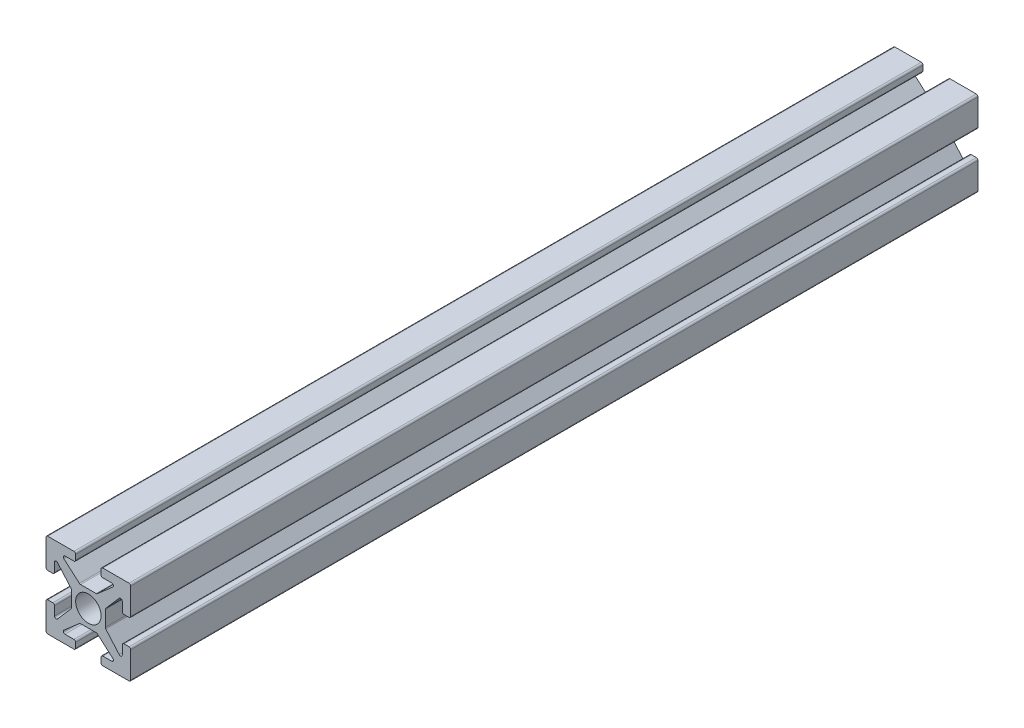
from build123d import *

# Parameters (mm, degrees)
MODEL_R             = 1.5
BOSS_EXTRUDE1_DEPTH = 100


with BuildPart() as part:
    # Model → Boss-Extrude1 (new body)
    with BuildSketch(Plane.XY):
        with BuildLine():
            Line((1314.74049485, 1308.470665301), (1314.74049485, 1305.370671501))
            ThreePointArc((1314.74049485, 1305.370671501), (1314.681916323, 1305.229250427), (1314.54049525, 1305.170671901))
            Line((1314.54049525, 1305.170671901), (1311.44050145, 1305.170671901))
            ThreePointArc((1311.44050145, 1305.170671901), (1311.299080376, 1305.229250427), (1311.24050185, 1305.370671501))
            Line((1311.24050185, 1305.370671501), (1311.24050185, 1305.970670301))
            ThreePointArc((1311.24050185, 1305.970670301), (1311.299080376, 1306.112091374), (1311.44050145, 1306.170669901))
            Line((1311.44050145, 1306.170669901), (1312.499844139, 1306.170669901))
            ThreePointArc((1312.499844139, 1306.170669901), (1312.687118906, 1306.300469773), (1312.631310779, 1306.521388984))
            Line((1312.631310779, 1306.521388984), (1310.796999872, 1308.121385784))
            ThreePointArc((1310.796999872, 1308.121385784), (1310.735732961, 1308.157941067), (1310.665533233, 1308.170665901))
            Line((1310.665533233, 1308.170665901), (1308.815476467, 1308.170665901))
            ThreePointArc((1308.815476467, 1308.170665901), (1308.745276739, 1308.157941067), (1308.684009827, 1308.121385784))
            Line((1308.684009827, 1308.121385784), (1306.849698921, 1306.521388984))
            ThreePointArc((1306.849698921, 1306.521388984), (1306.793890794, 1306.300469773), (1306.98116556, 1306.170669901))
            Line((1306.98116556, 1306.170669901), (1308.04050825, 1306.170669901))
            ThreePointArc((1308.04050825, 1306.170669901), (1308.181929323, 1306.112091374), (1308.24050785, 1305.970670301))
            Line((1308.24050785, 1305.970670301), (1308.24050785, 1305.370671501))
            ThreePointArc((1308.24050785, 1305.370671501), (1308.181929323, 1305.229250427), (1308.04050825, 1305.170671901))
            Line((1308.04050825, 1305.170671901), (1304.94051445, 1305.170671901))
            ThreePointArc((1304.94051445, 1305.170671901), (1304.799093376, 1305.229250427), (1304.74051485, 1305.370671501))
            Line((1304.74051485, 1305.370671501), (1304.74051485, 1308.470665301))
            ThreePointArc((1304.74051485, 1308.470665301), (1304.799093376, 1308.612086374), (1304.94051445, 1308.670664901))
            Line((1304.94051445, 1308.670664901), (1305.54051325, 1308.670664901))
            ThreePointArc((1305.54051325, 1308.670664901), (1305.681934323, 1308.612086374), (1305.74051285, 1308.470665301))
            Line((1305.74051285, 1308.470665301), (1305.74051285, 1307.411322611))
            ThreePointArc((1305.74051285, 1307.411322611), (1305.870312722, 1307.224047845), (1306.091231933, 1307.279855972))
            Line((1306.091231933, 1307.279855972), (1307.691228733, 1309.114166878))
            ThreePointArc((1307.691228733, 1309.114166878), (1307.727784016, 1309.17543379), (1307.74050885, 1309.245633518))
            Line((1307.74050885, 1309.245633518), (1307.74050885, 1311.095690284))
            ThreePointArc((1307.74050885, 1311.095690284), (1307.727784016, 1311.165890012), (1307.691228733, 1311.227156923))
            Line((1307.691228733, 1311.227156923), (1306.091231933, 1313.06146783))
            ThreePointArc((1306.091231933, 1313.06146783), (1305.870312722, 1313.117275957), (1305.74051285, 1312.93000119))
            Line((1305.74051285, 1312.93000119), (1305.74051285, 1311.870658501))
            ThreePointArc((1305.74051285, 1311.870658501), (1305.681934323, 1311.729237427), (1305.54051325, 1311.670658901))
            Line((1305.54051325, 1311.670658901), (1304.94051445, 1311.670658901))
            ThreePointArc((1304.94051445, 1311.670658901), (1304.799093376, 1311.729237427), (1304.74051485, 1311.870658501))
            Line((1304.74051485, 1311.870658501), (1304.74051485, 1314.970652301))
            ThreePointArc((1304.74051485, 1314.970652301), (1304.799093376, 1315.112073374), (1304.94051445, 1315.170651901))
            Line((1304.94051445, 1315.170651901), (1308.04050825, 1315.170651901))
            ThreePointArc((1308.04050825, 1315.170651901), (1308.181929323, 1315.112073374), (1308.24050785, 1314.970652301))
            Line((1308.24050785, 1314.970652301), (1308.24050785, 1314.370653501))
            ThreePointArc((1308.24050785, 1314.370653501), (1308.181929323, 1314.229232427), (1308.04050825, 1314.170653901))
            Line((1308.04050825, 1314.170653901), (1306.98116556, 1314.170653901))
            ThreePointArc((1306.98116556, 1314.170653901), (1306.793890794, 1314.040854029), (1306.849698921, 1313.819934817))
            Line((1306.849698921, 1313.819934817), (1308.684009827, 1312.219938017))
            ThreePointArc((1308.684009827, 1312.219938017), (1308.745276739, 1312.183382734), (1308.815476467, 1312.170657901))
            Line((1308.815476467, 1312.170657901), (1310.665533233, 1312.170657901))
            ThreePointArc((1310.665533233, 1312.170657901), (1310.735732961, 1312.183382734), (1310.796999872, 1312.219938017))
            Line((1310.796999872, 1312.219938017), (1312.631310779, 1313.819934817))
            ThreePointArc((1312.631310779, 1313.819934817), (1312.687118906, 1314.040854029), (1312.499844139, 1314.170653901))
            Line((1312.499844139, 1314.170653901), (1311.44050145, 1314.170653901))
            ThreePointArc((1311.44050145, 1314.170653901), (1311.299080376, 1314.229232427), (1311.24050185, 1314.370653501))
            Line((1311.24050185, 1314.370653501), (1311.24050185, 1314.970652301))
            ThreePointArc((1311.24050185, 1314.970652301), (1311.299080376, 1315.112073374), (1311.44050145, 1315.170651901))
            Line((1311.44050145, 1315.170651901), (1314.54049525, 1315.170651901))
            ThreePointArc((1314.54049525, 1315.170651901), (1314.681916323, 1315.112073374), (1314.74049485, 1314.970652301))
            Line((1314.74049485, 1314.970652301), (1314.74049485, 1311.870658501))
            ThreePointArc((1314.74049485, 1311.870658501), (1314.681916323, 1311.729237427), (1314.54049525, 1311.670658901))
            Line((1314.54049525, 1311.670658901), (1313.94049645, 1311.670658901))
            ThreePointArc((1313.94049645, 1311.670658901), (1313.799075376, 1311.729237427), (1313.74049685, 1311.870658501))
            Line((1313.74049685, 1311.870658501), (1313.74049685, 1312.93000119))
            ThreePointArc((1313.74049685, 1312.93000119), (1313.610696978, 1313.117275957), (1313.389777766, 1313.06146783))
            Line((1313.389777766, 1313.06146783), (1311.789780966, 1311.227156923))
            ThreePointArc((1311.789780966, 1311.227156923), (1311.753225683, 1311.165890012), (1311.74050085, 1311.095690284))
            Line((1311.74050085, 1311.095690284), (1311.74050085, 1309.245633518))
            ThreePointArc((1311.74050085, 1309.245633518), (1311.753225683, 1309.17543379), (1311.789780966, 1309.114166878))
            Line((1311.789780966, 1309.114166878), (1313.389777766, 1307.279855972))
            ThreePointArc((1313.389777766, 1307.279855972), (1313.610696978, 1307.224047845), (1313.74049685, 1307.411322611))
            Line((1313.74049685, 1307.411322611), (1313.74049685, 1308.470665301))
            ThreePointArc((1313.74049685, 1308.470665301), (1313.799075376, 1308.612086374), (1313.94049645, 1308.670664901))
            Line((1313.94049645, 1308.670664901), (1314.54049525, 1308.670664901))
            ThreePointArc((1314.54049525, 1308.670664901), (1314.681916323, 1308.612086374), (1314.74049485, 1308.470665301))
        make_face()
        with Locations((1309.74050485, 1310.170661901)):
            Circle(MODEL_R, mode=Mode.SUBTRACT)
    extrude(amount=BOSS_EXTRUDE1_DEPTH)


solid = part.part
